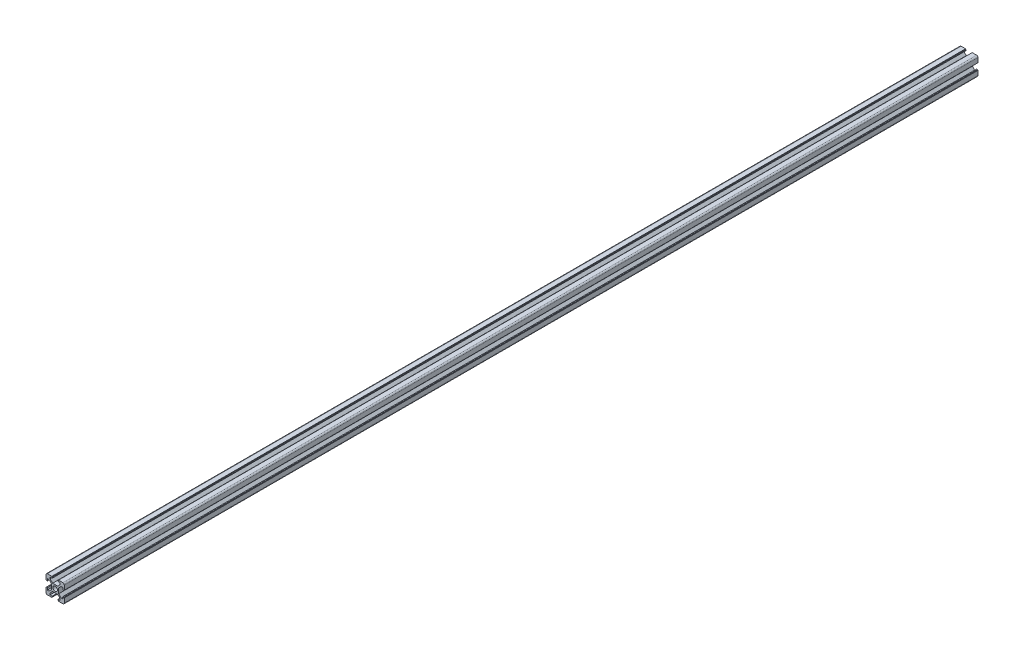
from build123d import *

# Parameters (mm, degrees)
SKETCH1_R                = 2.5
F_20_X_20_X_R1_5_1_DEPTH = 1000


with BuildPart() as part:
    # Sketch1 → 铝型材 20 X 20 X R1.5(1) (new body)
    with BuildSketch(Plane.XY.offset(-500)):
        with BuildLine():
            Line((-3.6, 10), (-3.6, 9.5))
            Line((-3.6, 9.5), (-3.1, 9.5))
            Line((-3.1, 9.5), (-3.1, 8.5))
            Line((-3.1, 8.5), (-5.5, 8.5))
            Line((-5.5, 8.5), (-5.5, 6.65))
            Line((-5.5, 6.65), (-2.75, 3.9))
            Line((-2.75, 3.9), (2.75, 3.9))
            Line((2.75, 3.9), (5.5, 6.65))
            Line((5.5, 6.65), (5.5, 8.5))
            Line((5.5, 8.5), (3.1, 8.5))
            Line((3.1, 8.5), (3.1, 9.5))
            Line((3.1, 9.5), (3.6, 9.5))
            Line((3.6, 9.5), (3.6, 10))
            Line((3.6, 10), (8.5, 10))
            ThreePointArc((8.5, 10), (9.560660172, 9.560660172), (10, 8.5))
            Line((10, 8.5), (10, 3.6))
            Line((10, 3.6), (9.5, 3.6))
            Line((9.5, 3.6), (9.5, 3.1))
            Line((9.5, 3.1), (8.5, 3.1))
            Line((8.5, 3.1), (8.5, 5.5))
            Line((8.5, 5.5), (6.65, 5.5))
            Line((6.65, 5.5), (3.9, 2.75))
            Line((3.9, 2.75), (3.9, -2.75))
            Line((3.9, -2.75), (6.65, -5.5))
            Line((6.65, -5.5), (8.5, -5.5))
            Line((8.5, -5.5), (8.5, -3.1))
            Line((8.5, -3.1), (9.5, -3.1))
            Line((9.5, -3.1), (9.5, -3.6))
            Line((9.5, -3.6), (10, -3.6))
            Line((10, -3.6), (10, -8.5))
            ThreePointArc((10, -8.5), (9.560660172, -9.560660172), (8.5, -10))
            Line((8.5, -10), (3.6, -10))
            Line((3.6, -10), (3.6, -9.5))
            Line((3.6, -9.5), (3.1, -9.5))
            Line((3.1, -9.5), (3.1, -8.5))
            Line((3.1, -8.5), (5.5, -8.5))
            Line((5.5, -8.5), (5.5, -6.65))
            Line((5.5, -6.65), (2.75, -3.9))
            Line((2.75, -3.9), (-2.75, -3.9))
            Line((-2.75, -3.9), (-5.5, -6.65))
            Line((-5.5, -6.65), (-5.5, -8.5))
            Line((-5.5, -8.5), (-3.1, -8.5))
            Line((-3.1, -8.5), (-3.1, -9.5))
            Line((-3.1, -9.5), (-3.6, -9.5))
            Line((-3.6, -9.5), (-3.6, -10))
            Line((-3.6, -10), (-8.5, -10))
            ThreePointArc((-8.5, -10), (-9.560660172, -9.560660172), (-10, -8.5))
            Line((-10, -8.5), (-10, -3.6))
            Line((-10, -3.6), (-9.5, -3.6))
            Line((-9.5, -3.6), (-9.5, -3.1))
            Line((-9.5, -3.1), (-8.5, -3.1))
            Line((-8.5, -3.1), (-8.5, -5.5))
            Line((-8.5, -5.5), (-6.65, -5.5))
            Line((-6.65, -5.5), (-3.9, -2.75))
            Line((-3.9, -2.75), (-3.9, 2.75))
            Line((-3.9, 2.75), (-6.65, 5.5))
            Line((-6.65, 5.5), (-8.5, 5.5))
            Line((-8.5, 5.5), (-8.5, 3.1))
            Line((-8.5, 3.1), (-9.5, 3.1))
            Line((-9.5, 3.1), (-9.5, 3.6))
            Line((-9.5, 3.6), (-10, 3.6))
            Line((-10, 3.6), (-10, 8.5))
            ThreePointArc((-10, 8.5), (-9.560660172, 9.560660172), (-8.5, 10))
            Line((-8.5, 10), (-3.6, 10))
        make_face()
        Circle(SKETCH1_R, mode=Mode.SUBTRACT)
    extrude(amount=F_20_X_20_X_R1_5_1_DEPTH)


solid = part.part
